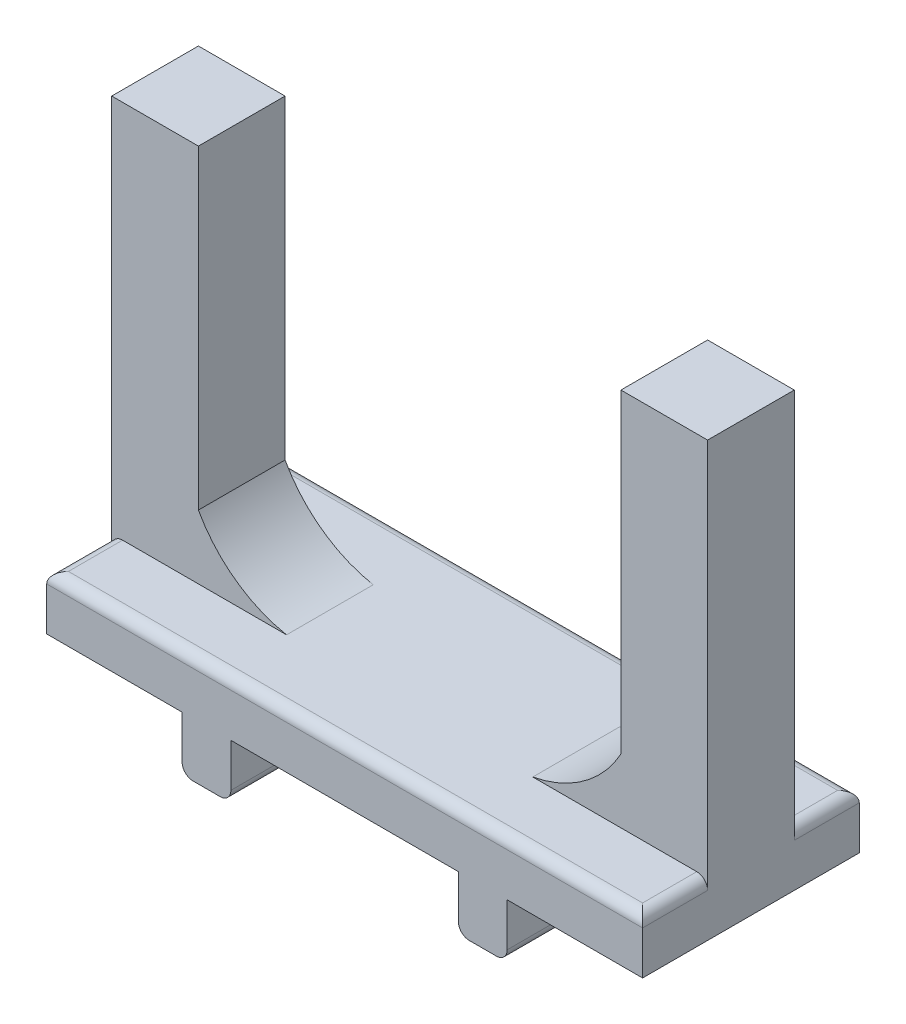
from build123d import *

# Parameters (mm, degrees)
SKETCH1_W           = 55
SKETCH1_H           = 5
SKETCH1_W_2         = 4.5
BOSS_EXTRUDE2_DEPTH = 20
SKETCH2_W           = 8
SKETCH2_H           = 8
BOSS_EXTRUDE3_DEPTH = 35
FILLET1_R           = 1
BOSS_EXTRUDE4_DEPTH = 4


with BuildPart() as part:
    # Sketch1 → Boss-Extrude2 (new body)
    with BuildSketch(Plane.XY):
        Rectangle(SKETCH1_W, SKETCH1_H)
        with Locations((-12.75, -5)):
            Rectangle(SKETCH1_W_2, SKETCH1_H)
        with Locations((12.75, -5)):
            Rectangle(SKETCH1_W_2, SKETCH1_H)
    extrude(amount=BOSS_EXTRUDE2_DEPTH)

    # Sketch2 → Boss-Extrude3 (add)
    with BuildSketch(Plane(origin=(0, 2.5, 0), x_dir=(1, 0, 0), z_dir=(0, 1, 0))):
        with Locations((23.5, -10)):
            Rectangle(SKETCH2_W, SKETCH2_H)
        with Locations((-23.5, -10)):
            Rectangle(SKETCH2_W, SKETCH2_H)
    extrude(amount=BOSS_EXTRUDE3_DEPTH)

    # Fillet1
    fillet1_edges = [part.edges().sort_by_distance(p)[0] for p in [
        (0, 2.5, 20),
        (0, 2.5, 0),
        (15, -7.5, 10),
        (10.5, -7.5, 10),
        (-10.5, -7.5, 10),
        (-15, -7.5, 10),
        (-27.5, 2.5, 17),
        (27.5, 2.5, 17),
        (-27.5, 2.5, 3),
        (27.5, 2.5, 3),
    ]]
    fillet(fillet1_edges, radius=FILLET1_R)

    # Sketch9 → Boss-Extrude4 (add, symmetric)
    with BuildSketch(Plane.XY.offset(10)):
        with BuildLine():
            Line((-19.5, 8.405065213), (-19.5, 2.5))
            Line((-19.5, 2.5), (-11.364093889, 2.5))
            ThreePointArc((-11.364093889, 2.5), (-16.092079197, 4.543150534), (-19.5, 8.405065213))
        make_face()
    boss_extrude4 = extrude(amount=BOSS_EXTRUDE4_DEPTH, both=True)

    # Mirror1: Boss-Extrude4 across plane
    add(boss_extrude4.mirror(Plane(origin=(0, 0, 0), x_dir=(0, 0, 1), z_dir=(1, 0, 0))))


solid = part.part
